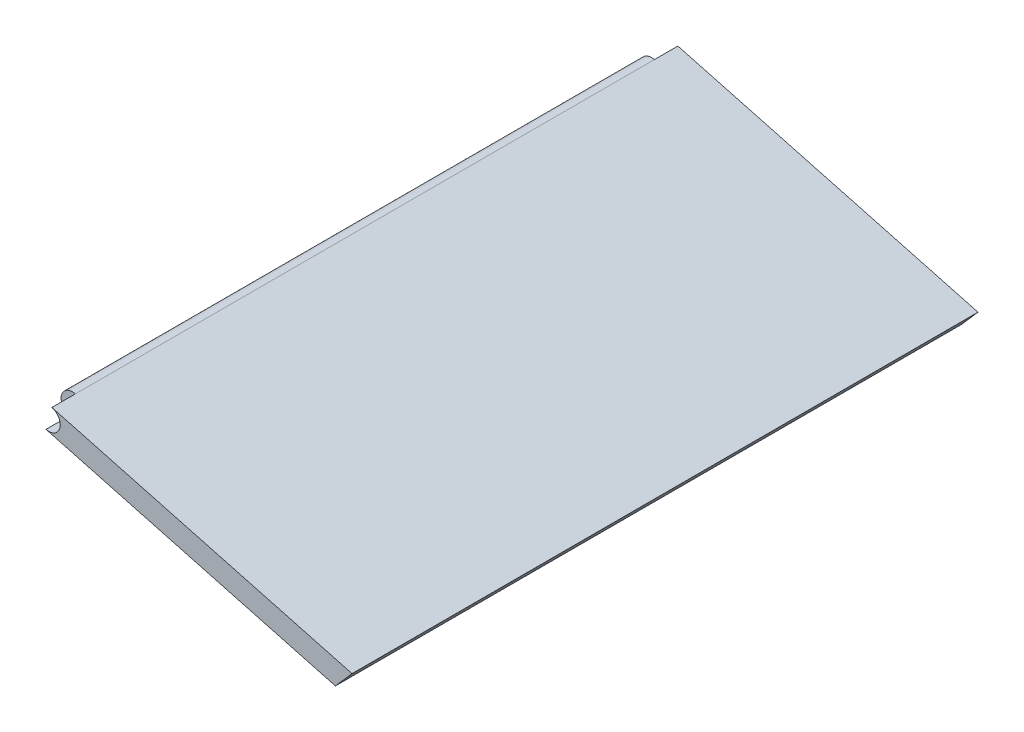
from build123d import *

# Parameters (mm, degrees)
AUFSATZ_LINEAR_AUSTRAGEN1_DEPTH = 800
SKIZZE3_R                       = 14.488887394
AUFSATZ_LINEAR_AUSTRAGEN2_DEPTH = 800
SKIZZE5_R                       = 14.488887394
SCHNITT_LINEAR_AUSTRAGEN1_DEPTH = 30
LINEARES_MUSTER1_COUNT          = 2
LINEARES_MUSTER1_PITCH          = 770


with BuildPart() as part:
    # Skizze1 → Aufsatz-Linear austragen1 (new body)
    with BuildSketch(Plane.XY):
        Polygon((0, 0), (383.588464136, -102.782219191), (362.338095958, -127.088200199), (0, -30), (-7.5, -27.990381057), align=None)
    extrude(amount=AUFSATZ_LINEAR_AUSTRAGEN1_DEPTH)

    # Skizze3 → Aufsatz-Linear austragen2 (add)
    with BuildSketch(Plane(origin=(0, 0, 0), x_dir=(-1, 0, 0), z_dir=(0, 0, -1))):
        with Locations((3.75, -13.995190528)):
            Circle(SKIZZE3_R)
    extrude(amount=-AUFSATZ_LINEAR_AUSTRAGEN2_DEPTH)

    # Skizze5 → Schnitt-Linear austragen1 (cut)
    with BuildSketch(Plane(origin=(0, 0, 0), x_dir=(-1, 0, 0), z_dir=(0, 0, -1))):
        with Locations((3.75, -13.995190528)):
            Circle(SKIZZE5_R)
    schnitt_linear_austragen1 = extrude(amount=-SCHNITT_LINEAR_AUSTRAGEN1_DEPTH, mode=Mode.SUBTRACT)

    # Lineares Muster1: Schnitt-Linear austragen1 ×2
    with Locations(*[(0, 0, i * LINEARES_MUSTER1_PITCH) for i in range(1, LINEARES_MUSTER1_COUNT)]):
        add(schnitt_linear_austragen1, mode=Mode.SUBTRACT)


solid = part.part
